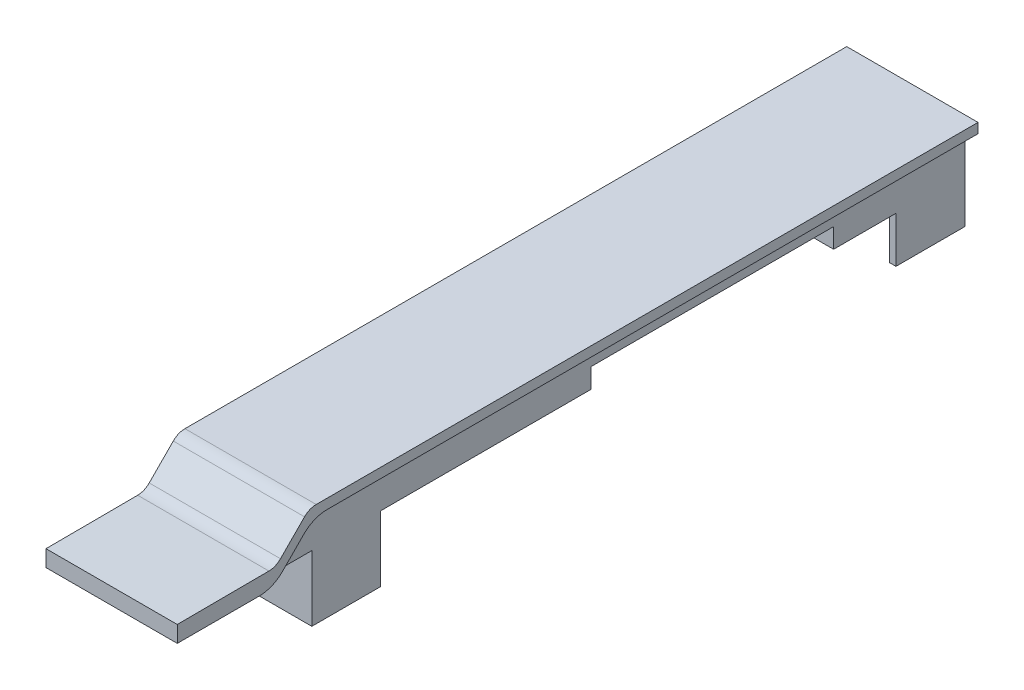
from build123d import *

# Parameters (mm, degrees)
BOSS_EXTRUDE1_DEPTH = 40
CUT_EXTRUDE2_DEPTH  = 4
FILLET6_R           = 10
FILLET7_R           = 5
BOSS_EXTRUDE2_DEPTH = 20
BOSS_EXTRUDE3_DEPTH = 14


with BuildPart() as part:
    # Sketch1 → Boss-Extrude1 (new body)
    with BuildSketch(Plane(origin=(0, 0, 0), x_dir=(0, 0, -1), z_dir=(1, 0, 0))):
        Polygon((0, 0), (-130, 0), (-130, 5), (-100.000366453, 5.148280317), (-89.750475128, 15.5), (114, 15.5), (114, 0), (74, 0), (74, 6), (0, 6), align=None)
    extrude(amount=BOSS_EXTRUDE1_DEPTH)

    # Sketch6 → Cut-Extrude2 (cut)
    with BuildSketch(Plane(origin=(40, 0, 0), x_dir=(0, 0, -1), z_dir=(1, 0, 0))):
        Polygon((-100.876178749, 0), (114, 0), (114, 12.5), (-88.499139427, 12.5), align=None)
    cut_extrude2 = extrude(amount=-CUT_EXTRUDE2_DEPTH, mode=Mode.SUBTRACT)

    # Mirror3: Cut-Extrude2 across plane
    add(cut_extrude2.mirror(Plane(origin=(20, 0, 0), x_dir=(0, 0, 1), z_dir=(1, 0, 0))), mode=Mode.SUBTRACT)

    # Fillet6
    fillet6_edges = [part.edges().sort_by_distance(p)[0] for p in [
        (38, 0, 100.876178749),
        (38, 12.5, 88.499139427),
        (2, 0, 100.876178749),
        (2, 12.5, 88.499139427),
    ]]
    fillet(fillet6_edges, radius=FILLET6_R)

    # Fillet7
    fillet7_edges = [part.edges().sort_by_distance(p)[0] for p in [
        (20, 5.148280317, 100.000366453),
        (20, 15.5, 89.750475128),
    ]]
    fillet(fillet7_edges, radius=FILLET7_R)

    # Sketch7 → Boss-Extrude2 (add)
    with BuildSketch(Plane.XZ):
        Polygon((36, 85), (4, 85), (4, 64), (6, 64), (6, 83), (34, 83), (34, 64), (36, 64), align=None)
    extrude(amount=BOSS_EXTRUDE2_DEPTH)

    # Sketch9 → Boss-Extrude3 (add)
    with BuildSketch(Plane.XZ):
        Polygon((4, -114), (36, -114), (36, -93), (34, -93), (34, -112), (6, -112), (6, -93), (4, -93), align=None)
    extrude(amount=BOSS_EXTRUDE3_DEPTH)


solid = part.part
